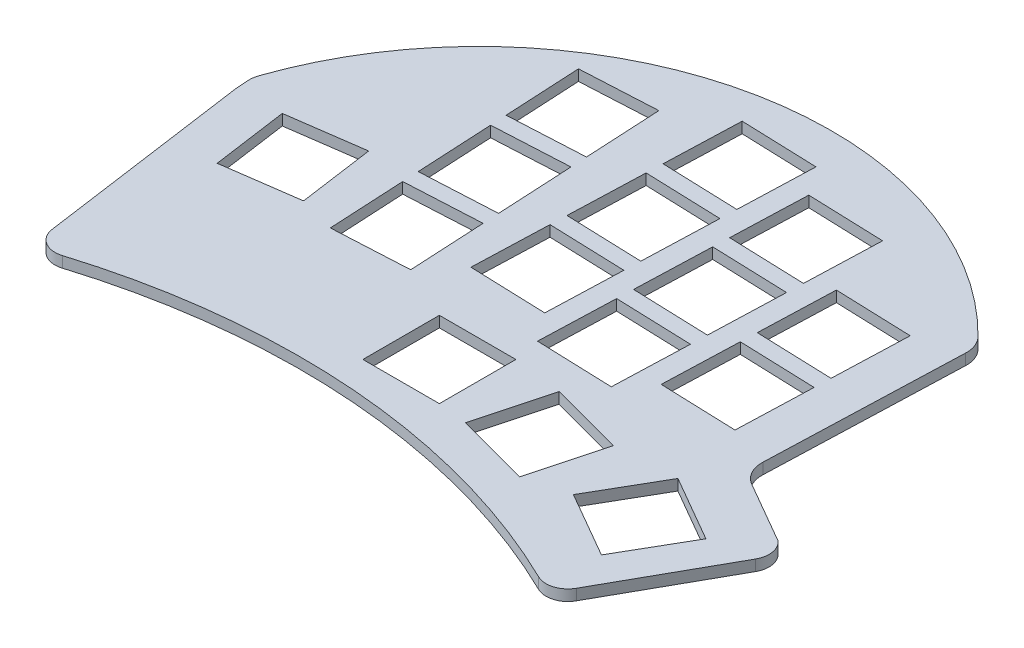
from build123d import *

# Parameters (mm, degrees)
SKETCH1_W           = 14
SKETCH1_H           = 14
BOSS_EXTRUDE1_DEPTH = 2
FILLET1_R           = 5


with BuildPart() as part:
    # Sketch1 → Boss-Extrude1 (new body)
    with BuildSketch(Plane(origin=(0, 0, 0), x_dir=(1, 0, 0), z_dir=(0, 1, 0))):
        with BuildLine():
            Line((-10.586983819, 42.383324584), (-5.046266953, 2.959075179))
            ThreePointArc((-5.046266953, 2.959075179), (-3.174441029, 0.368828473), (0, 0))
            ThreePointArc((0, 0), (47.971062986, 5.333423777), (94.542026123, -7.347809821))
            ThreePointArc((94.542026123, -7.347809821), (97.488396157, -7.568143239), (99.777690602, -5.700317192))
            Line((99.777690602, -5.700317192), (111.550095971, 15.354261283))
            ThreePointArc((111.550095971, 15.354261283), (112.008410414, 17.939225635), (110.765402582, 20.251589006))
            Line((110.765402582, 20.251589006), (96.765402582, 28.334492774))
            Line((96.765402582, 28.334492774), (98.196951267, 69.32867968))
            ThreePointArc((98.196951267, 69.32867968), (36.880667069, 88.690951376), (-10.814532638, 45.566107052))
            Line((-10.814532638, 45.566107052), (-10.586983819, 42.383324584))
        make_face()
        Polygon((-0.449562029, 28.794432983), (13.414190971, 30.742856383), (11.465767571, 44.606609383), (-2.397985429, 42.658185983), align=None, mode=Mode.SUBTRACT)
        Polygon((20.152865671, 28.899486483), (34.133679071, 29.632189883), (33.400975671, 43.613003283), (19.420162271, 42.880299883), align=None, mode=Mode.SUBTRACT)
        Polygon((19.263154371, 45.876188583), (33.243967771, 46.608891983), (32.511264371, 60.589705383), (18.530450971, 59.857001983), align=None, mode=Mode.SUBTRACT)
        Polygon((18.373443071, 62.852890683), (32.354256471, 63.585594083), (31.621553071, 77.566407483), (17.640739671, 76.833704083), align=None, mode=Mode.SUBTRACT)
        Polygon((39.247799271, 35.544672383), (53.239270871, 35.056079383), (53.727863871, 49.047550983), (39.736392271, 49.536143983), align=None, mode=Mode.SUBTRACT)
        Polygon((39.841090671, 52.534316483), (53.832562271, 52.045723483), (54.321155271, 66.037195083), (40.329683671, 66.525788083), align=None, mode=Mode.SUBTRACT)
        Polygon((40.434382071, 69.523960583), (54.425853671, 69.035367583), (54.914446671, 83.026839183), (40.922975071, 83.515432183), align=None, mode=Mode.SUBTRACT)
        Polygon((57.062336771, 29.919527383), (71.053808371, 29.430934383), (71.542401371, 43.422405983), (57.550929771, 43.910998983), align=None, mode=Mode.SUBTRACT)
        Polygon((57.655628171, 46.909171483), (71.647099771, 46.420578483), (72.135692771, 60.412050083), (58.144221171, 60.900643083), align=None, mode=Mode.SUBTRACT)
        Polygon((58.248919571, 63.898815583), (72.240391171, 63.410222583), (72.728984171, 77.401694183), (58.737512571, 77.890287183), align=None, mode=Mode.SUBTRACT)
        Polygon((75.229359071, 34.388229583), (89.220830671, 33.899636583), (89.709423671, 47.891108183), (75.717952071, 48.379701183), align=None, mode=Mode.SUBTRACT)
        Polygon((75.822650471, 51.377873683), (89.814122071, 50.889280683), (90.302715071, 64.880752283), (76.311243471, 65.369345283), align=None, mode=Mode.SUBTRACT)
        with Locations((50.981291271, 18.033609783)):
            Rectangle(SKETCH1_W, SKETCH1_H, mode=Mode.SUBTRACT)
        Polygon((63.408077171, 10.383862283), (76.931038771, 6.760395683), (80.554505371, 20.283357283), (67.031543771, 23.906823883), align=None, mode=Mode.SUBTRACT)
        Polygon((96.794438284, 1.879855106), (103.794438261, 14.00421072), (91.670082648, 21.004210697), (84.670082671, 8.879855083), align=None, mode=Mode.SUBTRACT)
    extrude(amount=BOSS_EXTRUDE1_DEPTH)

    # Fillet1
    fillet1_edges = [part.edges().sort_by_distance(p)[0] for p in [
        (96.765402582, 1, -28.334492774),
        (-10.814532638, 1, -45.566107052),
        (98.196951267, 1, -69.32867968),
    ]]
    fillet(fillet1_edges, radius=FILLET1_R)


solid = part.part
